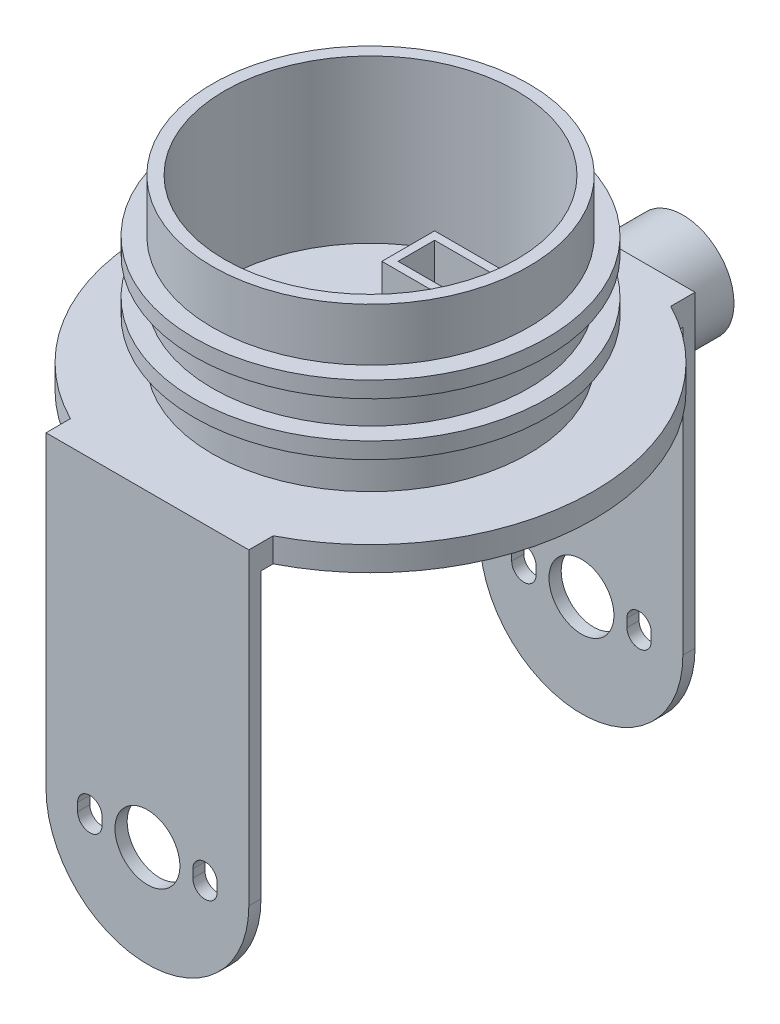
from build123d import *
from build123d.topology import SkipClean

# Parameters (mm, degrees)
SKETCH_1_R           = 19.5
SKETCH_1_R_2         = 18
EXTRUDE_1_DEPTH      = 20
SKETCH_3_R           = 27.5
EXTRUDE_2_DEPTH      = 3
EXTRUDE_START        = 2
SKETCH_25_R          = 21.75
SKETCH_25_R_2        = 19.5
EXTRUDE_12_DEPTH     = 2
EXTRUDE_START_2      = -1
SKETCH_26_R          = 21.75
SKETCH_26_R_2        = 19.5
EXTRUDE_13_DEPTH     = 2
SKETCH_27_W          = 25
SKETCH_27_H          = 53.5
EXTRUDE_14_DEPTH     = 3
SKETCH_28_R          = 4
EXTRUDE_17_DEPTH     = 1.5
EXTRUDE_START_3      = -53.5
SKETCH_28_25_R       = 4
EXTRUDE_25_DEPTH     = 53.5
CUT_EXTRUDE_START    = -52
SKETCH_28_27_R       = 4
CUT_EXTRUDE_15_DEPTH = 52
EXTRUDE_24_DEPTH     = 11
CUT_EXTRUDE_START_2  = -1.5
CUT_EXTRUDE_10_DEPTH = 1.5
SKETCH_34_W          = 10.2
SKETCH_34_H          = 6.5
SKETCH_34_W_2        = 8.2
SKETCH_34_H_2        = 4.5
EXTRUDE_22_DEPTH     = 5
SKETCH_37_W          = 8.2
SKETCH_37_H          = 4.5
CUT_EXTRUDE_9_DEPTH  = 5
EXTRUDE_26_DEPTH     = 8


with BuildPart() as part:
    # 草圖1 → 填料-伸長1 (new body)
    with BuildSketch(Plane(origin=(0, 0, 0), x_dir=(1, 0, 0), z_dir=(0, 1, 0))):
        Circle(SKETCH_1_R)
        Circle(SKETCH_1_R_2, mode=Mode.SUBTRACT)
    extrude(amount=EXTRUDE_1_DEPTH)

    # 草圖3 → 填料-伸長2 (add)
    with BuildSketch(Plane.XZ):
        Circle(SKETCH_3_R)
    extrude(amount=EXTRUDE_2_DEPTH)

    # 草圖25 → 填料-伸長12 (add)
    with BuildSketch(Plane(origin=(0, 7, 0), x_dir=(-1, 0, 0), z_dir=(0, -1, 0)).offset(EXTRUDE_START)):
        Circle(SKETCH_25_R)
        Circle(SKETCH_25_R_2, mode=Mode.SUBTRACT)
    extrude(amount=-EXTRUDE_12_DEPTH)

    # 草圖26 → 填料-伸長13 (add)
    with BuildSketch(Plane(origin=(0, 10.5, 0), x_dir=(-1, 0, 0), z_dir=(0, -1, 0)).offset(EXTRUDE_START_2)):
        Circle(SKETCH_26_R)
        Circle(SKETCH_26_R_2, mode=Mode.SUBTRACT)
    extrude(amount=-EXTRUDE_13_DEPTH)

    # 草圖27 → 填料-伸長14 (add)
    with BuildSketch(Plane.XZ.offset(3)):
        with Locations((0, 0.75)):
            Rectangle(SKETCH_27_W, SKETCH_27_H)
    extrude(amount=-EXTRUDE_14_DEPTH)

    # 草圖28 → 填料-伸長17 (add)
    with BuildSketch(Plane(origin=(0, 0, -26), x_dir=(-1, 0, 0), z_dir=(0, 0, -1))):
        with BuildLine():
            Line((12.5, 0), (-12.5, 0))
            Line((-12.5, 0), (-12.5, -38))
            ThreePointArc((-12.5, -38), (0, -50.5), (12.5, -38))
            Line((12.5, -38), (12.5, 0))
        make_face()
        with BuildLine():
            Line((8.6, -37.5), (8.6, -38.5))
            ThreePointArc((8.6, -38.5), (7.1, -40), (5.6, -38.5))
            Line((5.6, -38.5), (5.6, -37.5))
            ThreePointArc((5.6, -37.5), (7.1, -36), (8.6, -37.5))
        make_face(mode=Mode.SUBTRACT)
        with Locations((0, -38)):
            Circle(SKETCH_28_R, mode=Mode.SUBTRACT)
        with BuildLine():
            Line((-5.6, -37.5), (-5.6, -38.5))
            ThreePointArc((-5.6, -38.5), (-7.1, -40), (-8.6, -38.5))
            Line((-8.6, -38.5), (-8.6, -37.5))
            ThreePointArc((-8.6, -37.5), (-7.1, -36), (-5.6, -37.5))
        make_face(mode=Mode.SUBTRACT)
    extrude(amount=EXTRUDE_17_DEPTH)

    # 草圖28<25> → 填料-伸長25 (add)
    with BuildSketch(Plane(origin=(0, 0, -26), x_dir=(-1, 0, 0), z_dir=(0, 0, -1)).offset(EXTRUDE_START_3)):
        with BuildLine():
            Line((12.5, -38), (12.5, -3))
            Line((12.5, -3), (-12.5, -3))
            Line((-12.5, -3), (-12.5, -38))
            ThreePointArc((-12.5, -38), (0, -50.5), (12.5, -38))
        make_face()
        with BuildLine():
            Line((8.6, -37.5), (8.6, -38.5))
            ThreePointArc((8.6, -38.5), (7.1, -40), (5.6, -38.5))
            Line((5.6, -38.5), (5.6, -37.5))
            ThreePointArc((5.6, -37.5), (7.1, -36), (8.6, -37.5))
        make_face(mode=Mode.SUBTRACT)
        with Locations((0, -38)):
            Circle(SKETCH_28_25_R, mode=Mode.SUBTRACT)
        with BuildLine():
            Line((-5.6, -37.5), (-5.6, -38.5))
            ThreePointArc((-5.6, -38.5), (-7.1, -40), (-8.6, -38.5))
            Line((-8.6, -38.5), (-8.6, -37.5))
            ThreePointArc((-8.6, -37.5), (-7.1, -36), (-5.6, -37.5))
        make_face(mode=Mode.SUBTRACT)
    extrude(amount=EXTRUDE_25_DEPTH)

    # 草圖28<27> → 除料-伸長15 (cut)
    with BuildSketch(Plane(origin=(0, 0, -26), x_dir=(-1, 0, 0), z_dir=(0, 0, -1)).offset(CUT_EXTRUDE_START)):
        with BuildLine():
            Line((12.5, -38), (12.5, -3))
            Line((12.5, -3), (-12.5, -3))
            Line((-12.5, -3), (-12.5, -38))
            ThreePointArc((-12.5, -38), (0, -50.5), (12.5, -38))
        make_face()
        with BuildLine():
            Line((8.6, -37.5), (8.6, -38.5))
            ThreePointArc((8.6, -38.5), (7.1, -40), (5.6, -38.5))
            Line((5.6, -38.5), (5.6, -37.5))
            ThreePointArc((5.6, -37.5), (7.1, -36), (8.6, -37.5))
        make_face(mode=Mode.SUBTRACT)
        with Locations((0, -38)):
            Circle(SKETCH_28_27_R, mode=Mode.SUBTRACT)
        with BuildLine():
            Line((-5.6, -37.5), (-5.6, -38.5))
            ThreePointArc((-5.6, -38.5), (-7.1, -40), (-8.6, -38.5))
            Line((-8.6, -38.5), (-8.6, -37.5))
            ThreePointArc((-8.6, -37.5), (-7.1, -36), (-5.6, -37.5))
        make_face(mode=Mode.SUBTRACT)
    extrude(amount=CUT_EXTRUDE_15_DEPTH, mode=Mode.SUBTRACT)

    # 草圖38<4> → 填料-伸長24 (add)
    with BuildSketch(Plane(origin=(0, 0, -27.5), x_dir=(-1, 0, 0), z_dir=(0, 0, -1))):
        with BuildLine():
            Line((-1.3125, -15.961764662), (-1, -14.494677838))
            ThreePointArc((-1, -14.494677838), (-3.019933774, -6.069048379), (4.8, -9.8))
            ThreePointArc((4.8, -9.8), (3.730951621, -12.819933774), (1, -14.494677838))
            Line((1, -14.494677838), (1.3125, -15.961764662))
            ThreePointArc((1.3125, -15.961764662), (4.896874003, -13.763663079), (6.3, -9.8))
            ThreePointArc((6.3, -9.8), (-3.963663079, -4.903125997), (-1.3125, -15.961764662))
        make_face()
    extrude(amount=EXTRUDE_24_DEPTH)

    # 草圖38 → 除料-伸長10 (cut)
    with SkipClean():  # the faces are left unmerged after this step: merging them gives an invalid solid
        with BuildSketch(Plane(origin=(0, 0, -27.5), x_dir=(-1, 0, 0), z_dir=(0, 0, -1)).offset(CUT_EXTRUDE_START_2)):
            with BuildLine():
                ThreePointArc((4.8, -9.8), (-3.019933774, -6.069048379), (-1, -14.494677838))
                ThreePointArc((-1, -14.494677838), (0, -14.6), (1, -14.494677838))
                ThreePointArc((1, -14.494677838), (3.730951621, -12.819933774), (4.8, -9.8))
            make_face()
        extrude(amount=CUT_EXTRUDE_10_DEPTH, mode=Mode.SUBTRACT)

    # 草圖34 → 填料-伸長22 (add)
    with SkipClean():  # the faces are left unmerged after this step: merging them gives an invalid solid
        with BuildSketch(Plane(origin=(0, 0, 0), x_dir=(1, 0, 0), z_dir=(0, 1, 0))):
            with Locations((0, 9.75)):
                Rectangle(SKETCH_34_W, SKETCH_34_H)
            with Locations((0, 9.75)):
                Rectangle(SKETCH_34_W_2, SKETCH_34_H_2, mode=Mode.SUBTRACT)
        extrude(amount=EXTRUDE_22_DEPTH)

    # 草圖37 → 除料-伸長9 (cut)
    with SkipClean():  # the faces are left unmerged after this step: merging them gives an invalid solid
        with BuildSketch(Plane(origin=(0, 0, 0), x_dir=(1, 0, 0), z_dir=(0, 1, 0))):
            with Locations((0, 9.75)):
                Rectangle(SKETCH_37_W, SKETCH_37_H)
        extrude(amount=-CUT_EXTRUDE_9_DEPTH, mode=Mode.SUBTRACT)

    # 草圖38<12> → 填料-伸長26 (add)
    with SkipClean():  # the faces are left unmerged after this step: merging them gives an invalid solid
        with BuildSketch(Plane(origin=(0, 0, -27.5), x_dir=(-1, 0, 0), z_dir=(0, 0, -1))):
            with BuildLine():
                ThreePointArc((1, -14.494677838), (0, -14.6), (-1, -14.494677838))
                Line((-1, -14.494677838), (-1.3125, -15.961764662))
                ThreePointArc((-1.3125, -15.961764662), (0, -16.1), (1.3125, -15.961764662))
                Line((1.3125, -15.961764662), (1, -14.494677838))
            make_face()
        extrude(amount=EXTRUDE_26_DEPTH)


solid = part.part
